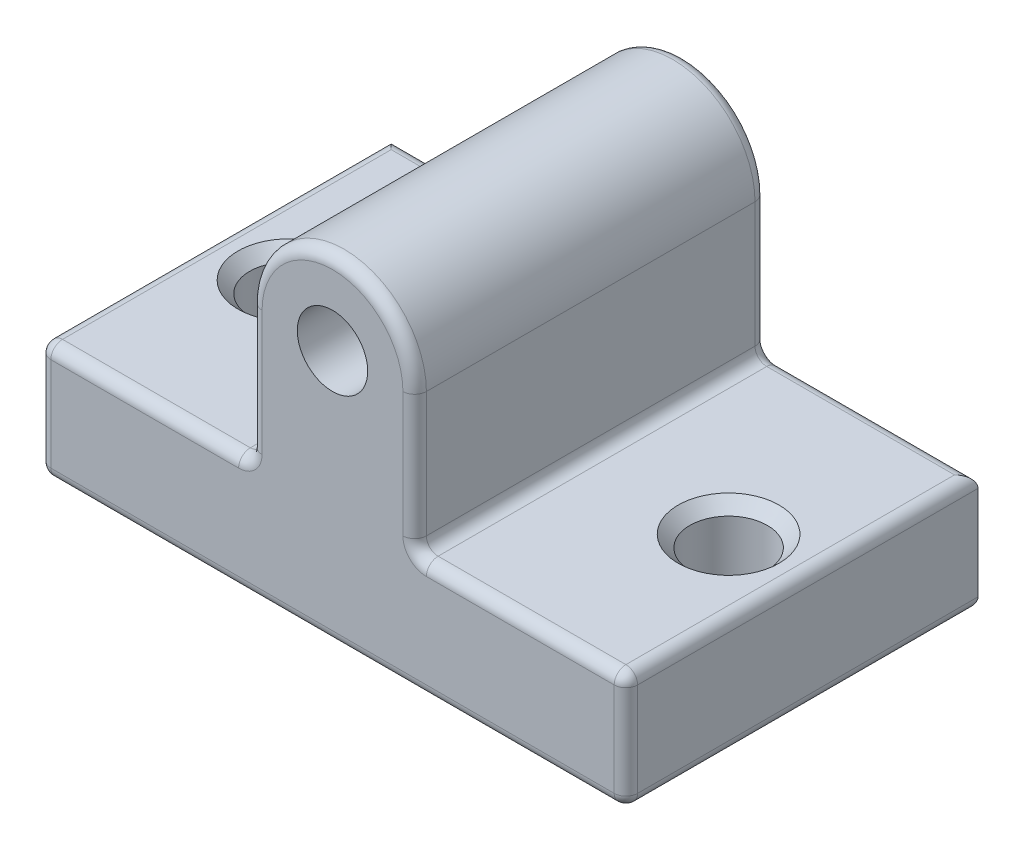
from build123d import *

# Parameters (mm, degrees)
SKETCH1_W           = 50
SKETCH1_H           = 10
BOSS_EXTRUDE1_DEPTH = 30
SKETCH2_R           = 3
BOSS_EXTRUDE2_DEPTH = 30
CUT_EXTRUDE1_REACH  = 45.277
SKETCH3_R           = 3.3
FILLET1_R           = 1
CHAMFER1_SIZE       = 1


with BuildPart() as part:
    # Sketch1 → Boss-Extrude1 (new body)
    with BuildSketch(Plane.XY):
        Rectangle(SKETCH1_W, SKETCH1_H)
    extrude(amount=BOSS_EXTRUDE1_DEPTH)

    # Sketch2 → Boss-Extrude2 (add)
    with BuildSketch(Plane.XY.offset(30)):
        with BuildLine():
            Line((-7, 5), (-7, 16.65178901))
            ThreePointArc((-7, 16.65178901), (0, 23.65178901), (7, 16.65178901))
            Line((7, 16.65178901), (7, 5))
            Line((7, 5), (-7, 5))
        make_face()
        with Locations((0, 16.65178901)):
            Circle(SKETCH2_R, mode=Mode.SUBTRACT)
    extrude(amount=-BOSS_EXTRUDE2_DEPTH)

    # Sketch3 → Cut-Extrude1 (cut, up to next)
    with BuildSketch(Plane(origin=(0, 5, 0), x_dir=(1, 0, 0), z_dir=(0, 1, 0)), mode=Mode.PRIVATE) as cut_extrude1_sk1:
        with Locations(Location((-18.75, -15, 0), (0, 0, 180))):
            Circle(SKETCH3_R)
    cut_extrude1_tool1 = extrude(cut_extrude1_sk1.sketch, amount=-CUT_EXTRUDE1_REACH, mode=Mode.PRIVATE) & part.part
    # Sketch3 → Cut-Extrude1 (cut, up to next)
    with BuildSketch(Plane(origin=(0, 5, 0), x_dir=(1, 0, 0), z_dir=(0, 1, 0)), mode=Mode.PRIVATE) as cut_extrude1_sk2:
        with Locations(Location((18.75, -15, 0), (0, 0, 180))):
            Circle(SKETCH3_R)
    cut_extrude1_tool2 = extrude(cut_extrude1_sk2.sketch, amount=-CUT_EXTRUDE1_REACH, mode=Mode.PRIVATE) & part.part
    add(cut_extrude1_tool1.solids().sort_by_distance((-18.75, 5, 15))[0], mode=Mode.SUBTRACT)
    add(cut_extrude1_tool2.solids().sort_by_distance((18.75, 5, 15))[0], mode=Mode.SUBTRACT)

    # Fillet1
    fillet1_edges = [part.edges().sort_by_distance(p)[0] for p in [
        (25, 0, 30),
        (-16, 5, 0),
        (-16, 5, 30),
        (16, 5, 30),
        (-7, 5, 15),
        (7, 5, 15),
        (7, 10.825894505, 30),
        (0, 23.65178901, 30),
        (-7, 10.825894505, 30),
        (-7, 10.825894505, 0),
        (0, 23.65178901, 0),
        (7, 10.825894505, 0),
        (-25, 0, 30),
        (16, 5, 0),
        (0, -5, 0),
        (-25, 5, 15),
        (25, 5, 15),
        (25, -5, 15),
        (-25, -5, 15),
        (0, -5, 30),
    ]]
    fillet(fillet1_edges, radius=FILLET1_R)

    # Chamfer1
    chamfer1_edges = [part.edges().sort_by_distance(p)[0] for p in [
        (-15.45, 5, 15),
        (22.05, 5, 15),
    ]]
    chamfer(chamfer1_edges, length=CHAMFER1_SIZE)


solid = part.part
